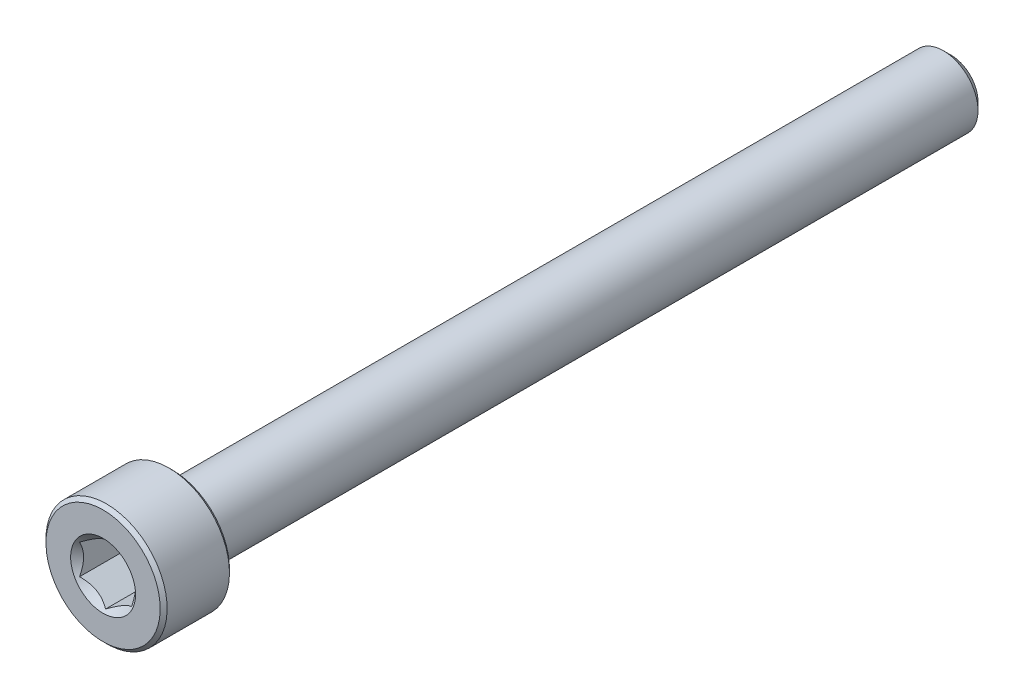
from build123d import *

# Parameters (mm, degrees)
CUT_EXTRUDE1_DEPTH = 3


with BuildPart() as part:
    # Sketch2 → Revolve1 (revolve)
    with BuildSketch(Plane(origin=(0, 0, 0), x_dir=(0, 0, -1), z_dir=(1, 0, 0))):
        with BuildLine():
            Line((-24.5, 0), (-24.5, 3.3))
            Line((-24.5, 3.3), (-24.3, 3.5))
            Line((-24.3, 3.5), (-20.7, 3.5))
            Line((-20.7, 3.5), (-20.5, 3.3))
            Line((-20.5, 3.3), (-20.5, 2.2))
            ThreePointArc((-20.5, 2.2), (-20.441421356, 2.058578644), (-20.3, 2))
            Line((-20.3, 2), (24.045336663, 2))
            Line((24.045336663, 2), (24.5, 1.545336663))
            Line((24.5, 1.545336663), (24.5, 0))
            Line((24.5, 0), (-24.5, 0))
        make_face()
    revolve(axis=Axis((0, 0, -24.5), (0, 0, 1)))

    # Sketch3 → Cut-Extrude1 (cut)
    with BuildSketch(Plane.XY.offset(24.5)):
        Polygon((1.5, -0.866025404), (1.5, 0.866025404), (0, 1.732050808), (-1.5, 0.866025404), (-1.5, -0.866025404), (0, -1.732050808), align=None)
    extrude(amount=-CUT_EXTRUDE1_DEPTH, mode=Mode.SUBTRACT)

    # Cut-Extrude2 cone 1 section (through the dimple's axis) → Cut-Extrude2 (revolve, cut)
    with BuildSketch(Plane(origin=(0, 0, 24.5), x_dir=(0, -1, 0), z_dir=(1, 0, 0))):
        Polygon((0, 0), (1.875, 0), (0, 1.875), align=None)
    revolve(axis=Axis((0, 0, 24.5), (0, 0, -1)), mode=Mode.SUBTRACT)


solid = part.part
